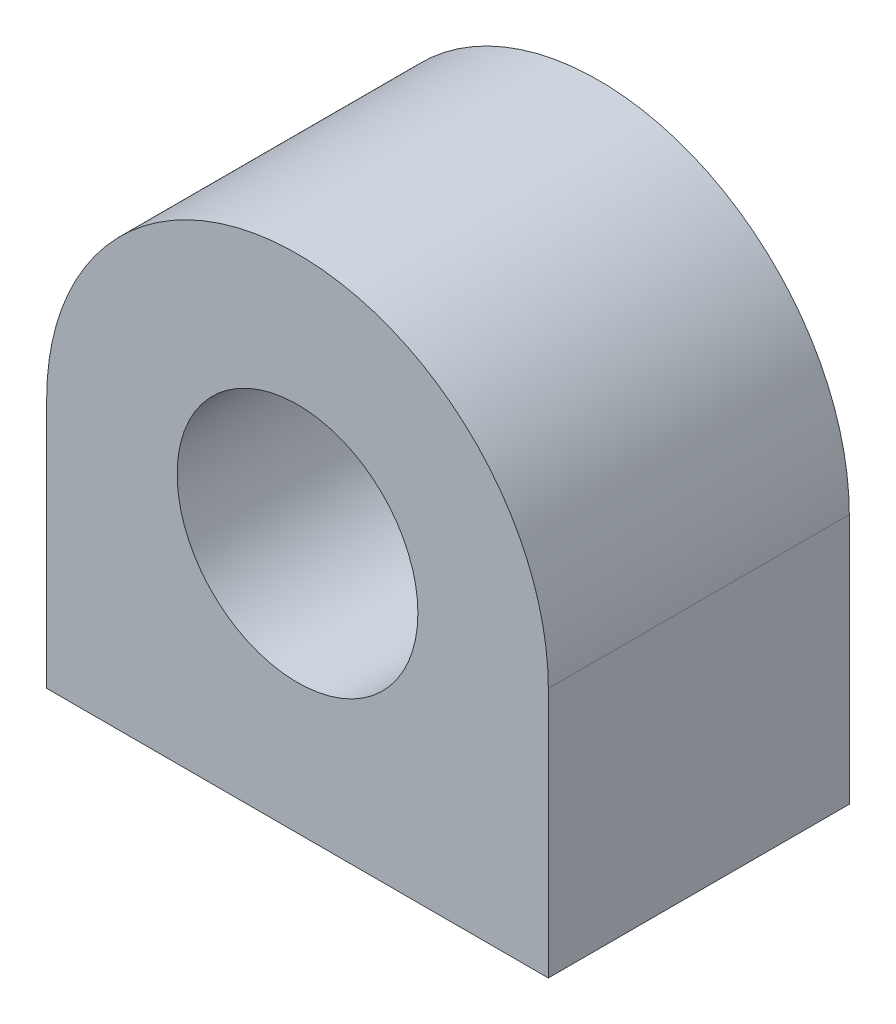
from build123d import *

# Parameters (mm, degrees)
SKETCH_1_R      = 12
EXTRUDE_1_DEPTH = 30


with BuildPart() as part:
    # 草图1 → 凸台-拉伸1 (new body)
    with BuildSketch(Plane.XY):
        with BuildLine():
            Line((-25, 0), (-25, -25))
            Line((-25, -25), (25, -25))
            Line((25, -25), (25, 0))
            ThreePointArc((25, 0), (0, 25), (-25, 0))
        make_face()
        Circle(SKETCH_1_R, mode=Mode.SUBTRACT)
    extrude(amount=EXTRUDE_1_DEPTH)


solid = part.part
